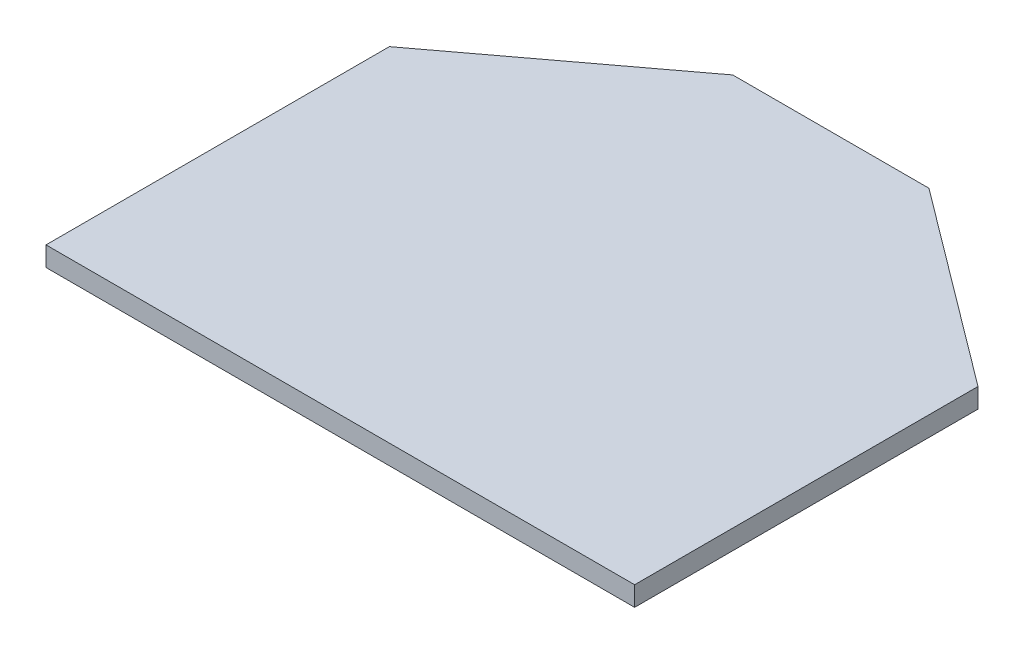
from build123d import *

# Parameters (mm, degrees)
BOSS_EXTRUDE1_DEPTH = 6


with BuildPart() as part:
    # Sketch1 → Boss-Extrude1 (new body)
    with BuildSketch(Plane(origin=(0, 0, 0), x_dir=(1, 0, 0), z_dir=(0, 1, 0))):
        Polygon((-90, 12.5), (-30, 57.5), (30, 57.5), (90, 12.5), (90, -92.5), (-90, -92.5), align=None)
    extrude(amount=BOSS_EXTRUDE1_DEPTH)


solid = part.part
